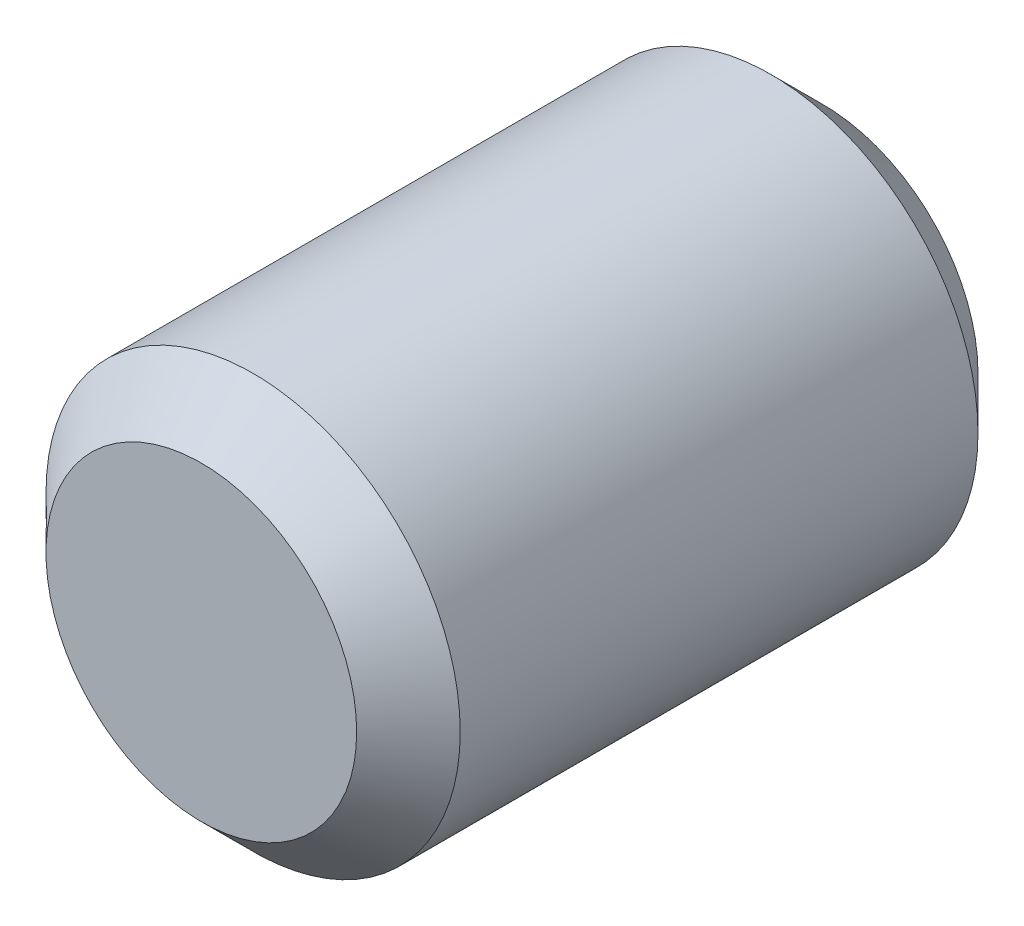
from build123d import *

# Parameters (mm, degrees)
IZIM1_R                     = 2
Y_KSEKLIK_EKSTR_ZYON1_DEPTH = 3
PAH1_SIZE                   = 0.5


with BuildPart() as part:
    # Çizim1 → Yükseklik-Ekstrüzyon1 (new, symmetric)
    with BuildSketch(Plane.XY):
        Circle(IZIM1_R)
    extrude(amount=Y_KSEKLIK_EKSTR_ZYON1_DEPTH, both=True)

    # Pah1
    pah1_edges = [part.edges().sort_by_distance(p)[0] for p in [
        (-2, 0, -3),
        (-2, 0, 3),
    ]]
    chamfer(pah1_edges, length=PAH1_SIZE)


solid = part.part
